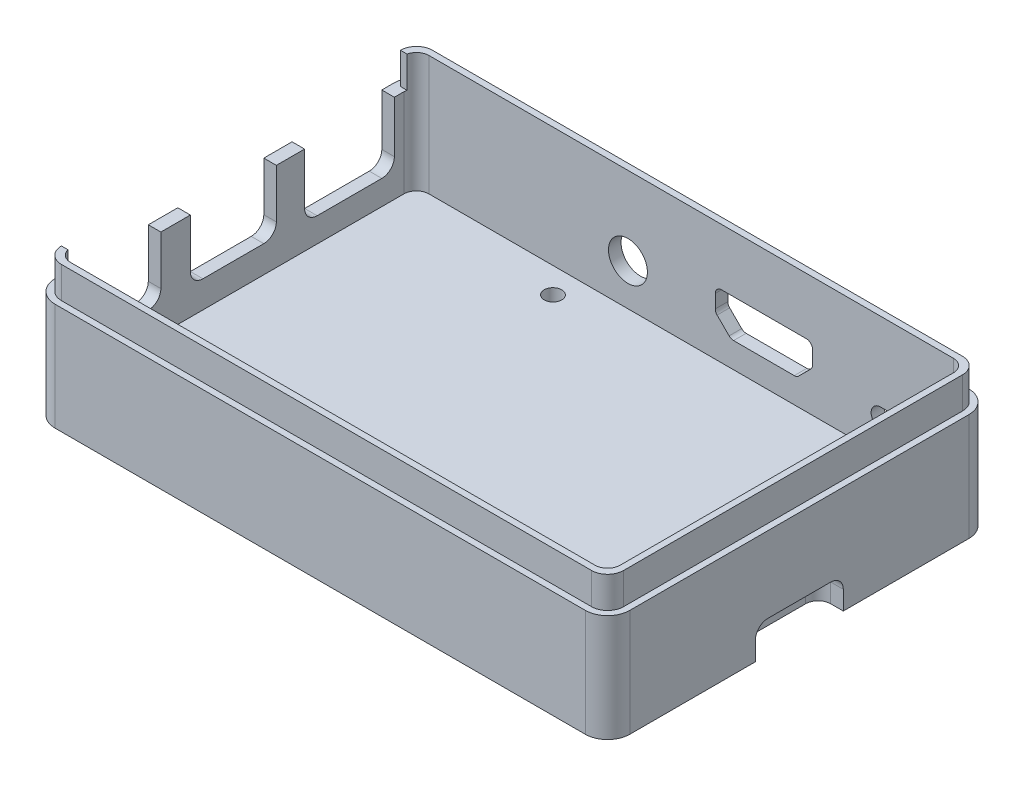
from build123d import *

# Parameters (mm, degrees)
SKETCH1_W                      = 86.55
SKETCH1_H                      = 17.1
BOSS_EXTRUDE1_DEPTH            = 14
SKETCH2_W                      = 88.55
SKETCH2_H                      = 17.1
BOSS_EXTRUDE2_DEPTH            = 23.55
SKETCH3_W                      = 37.55
SKETCH3_H                      = 17.1
BOSS_EXTRUDE3_DEPTH            = 2
SKETCH4_W                      = 90.55
SKETCH4_H                      = 17.1
BOSS_EXTRUDE4_DEPTH            = 23.55
SKETCH5_W                      = 2
SKETCH5_H                      = 14
CUT_EXTRUDE1_DEPTH             = 3
CUT_EXTRUDE2_DEPTH             = 14.1
SKETCH7_W                      = 2
SKETCH7_H                      = 14
CUT_EXTRUDE3_DEPTH             = 2
BOSS_EXTRUDE5_DEPTH            = 5
SKETCH9_W                      = 87.55
SKETCH9_H                      = 19.1
CUT_EXTRUDE4_DEPTH             = 1.55
SKETCH10_W                     = 61.1
SKETCH10_H                     = 17.1
BOSS_EXTRUDE6_DEPTH            = 1
CUT_EXTRUDE5_REACH             = 79.588
SKETCH11_W                     = 87.55
SKETCH11_H                     = 19.1
SKETCH12_W                     = 13.7
SKETCH12_H                     = 9.8
CUT_EXTRUDE6_DEPTH             = 127.470668932
SKETCH13_W                     = 13.7
SKETCH13_H                     = 9.8
CUT_EXTRUDE7_DEPTH             = 127.470668932
SKETCH14_W                     = 14.3
SKETCH14_H                     = 10.2
CUT_EXTRUDE8_DEPTH             = 127.470668932
CUT_EXTRUDE10_DEPTH            = 78.587821209
CUT_EXTRUDE11_REACH            = 81.122
F_2_8_2_8_DIAMETER_HOLE1_D     = 2.8
F_6_2_6_2_DIAMETER_HOLE1_D     = 6.2
F_6_2_6_2_DIAMETER_HOLE1_DEPTH = 2
FILLET1_R                      = 1
FILLET2_R                      = 2
FILLET3_R                      = 2.55
FILLET4_R                      = 3.55


with BuildPart() as part:
    # Sketch1 → Boss-Extrude1 (new body)
    with BuildSketch(Plane.XY.offset(63.69)):
        with Locations((-0.775, 5.55)):
            Rectangle(SKETCH1_W, SKETCH1_H)
    extrude(amount=-BOSS_EXTRUDE1_DEPTH)

    # Sketch2 → Boss-Extrude2 (add)
    with BuildSketch(Plane(origin=(0, 0, 49.69), x_dir=(-1, 0, 0), z_dir=(0, 0, -1))):
        with Locations((-0.225, 5.55)):
            Rectangle(SKETCH2_W, SKETCH2_H)
    extrude(amount=BOSS_EXTRUDE2_DEPTH)

    # Sketch3 → Boss-Extrude3 (add)
    with BuildSketch(Plane(origin=(44.5, 0, 0), x_dir=(0, 0, -1), z_dir=(1, 0, 0))):
        with Locations((-44.915, 5.55)):
            Rectangle(SKETCH3_W, SKETCH3_H)
    extrude(amount=BOSS_EXTRUDE3_DEPTH)

    # Sketch4 → Boss-Extrude4 (add)
    with BuildSketch(Plane.XY.offset(63.69)):
        with Locations((1.225, 5.55)):
            Rectangle(SKETCH4_W, SKETCH4_H)
    extrude(amount=BOSS_EXTRUDE4_DEPTH)

    # Sketch5 → Cut-Extrude1 (cut)
    with BuildSketch(Plane.XZ.offset(3)):
        with Locations((45.5, 56.69)):
            Rectangle(SKETCH5_W, SKETCH5_H)
    extrude(amount=-CUT_EXTRUDE1_DEPTH, mode=Mode.SUBTRACT)

    # Sketch6 → Cut-Extrude2 (cut)
    with BuildSketch(Plane(origin=(0, 14.1, 0), x_dir=(-1, 0, 0), z_dir=(0, 1, 0))):
        Polygon((43.05, 29.69), (43.05, 83.69), (-44.5, 83.69), (-44.5, 63.69), (-42.5, 63.69), (-42.5, 49.69), (-44.5, 49.69), (-44.5, 29.69), align=None)
    extrude(amount=-CUT_EXTRUDE2_DEPTH, mode=Mode.SUBTRACT)

    # Sketch7 → Cut-Extrude3 (cut)
    with BuildSketch(Plane.XZ):
        with Locations((45.5, 56.69)):
            Rectangle(SKETCH7_W, SKETCH7_H)
    extrude(amount=-CUT_EXTRUDE3_DEPTH, mode=Mode.SUBTRACT)

    # Sketch8 → Boss-Extrude5 (add)
    with BuildSketch(Plane(origin=(0, 14.1, 0), x_dir=(-1, 0, 0), z_dir=(0, 1, 0))):
        with BuildLine():
            Line((-44.5, 83.69), (-44.5, 29.69))
            Line((-44.5, 29.69), (44.05, 29.69))
            ThreePointArc((44.05, 29.69), (43.303122292, 27.886877708), (41.5, 27.14))
            Line((41.5, 27.14), (-45.5, 27.14))
            Line((-45.5, 27.14), (-45.5, 86.24))
            Line((-45.5, 86.24), (41.5, 86.24))
            ThreePointArc((41.5, 86.24), (43.303122292, 85.493122292), (44.05, 83.69))
            Line((44.05, 83.69), (-44.5, 83.69))
        make_face()
    extrude(amount=BOSS_EXTRUDE5_DEPTH)

    # Sketch9 → Cut-Extrude4 (cut)
    with BuildSketch(Plane(origin=(0, 0, 83.69), x_dir=(-1, 0, 0), z_dir=(0, 0, -1))):
        with Locations((-0.725, 9.55)):
            Rectangle(SKETCH9_W, SKETCH9_H)
    extrude(amount=-CUT_EXTRUDE4_DEPTH, mode=Mode.SUBTRACT)

    # Sketch10 → Boss-Extrude6 (add)
    with BuildSketch(Plane.ZY.offset(44.05)):
        with Locations((56.69, 5.55)):
            Rectangle(SKETCH10_W, SKETCH10_H)
    extrude(amount=BOSS_EXTRUDE6_DEPTH)

    # Sketch11 → Cut-Extrude5 (cut, up to next)
    with BuildSketch(Plane(origin=(0, 0, 28.14), x_dir=(-1, 0, 0), z_dir=(0, 0, -1)), mode=Mode.PRIVATE) as cut_extrude5_sk1:
        with Locations((-0.725, 9.55)):
            Rectangle(SKETCH11_W, SKETCH11_H)
    cut_extrude5_tool1 = extrude(cut_extrude5_sk1.sketch, amount=-CUT_EXTRUDE5_REACH, mode=Mode.PRIVATE) & part.part
    add(cut_extrude5_tool1.solids().sort_by_distance((0.725, 9.55, 28.14))[0], mode=Mode.SUBTRACT)

    # Sketch12 → Cut-Extrude6 (cut, through all)
    with BuildSketch(Plane(origin=(-43.05, 0, 0), x_dir=(0, 0, -1), z_dir=(1, 0, 0))):
        with Locations((-75.705690784, 9.2)):
            Rectangle(SKETCH12_W, SKETCH12_H)
    extrude(amount=-CUT_EXTRUDE6_DEPTH, mode=Mode.SUBTRACT)

    # Sketch13 → Cut-Extrude7 (cut, through all)
    with BuildSketch(Plane(origin=(-43.05, 0, 0), x_dir=(0, 0, -1), z_dir=(1, 0, 0))):
        with Locations((-57.305690784, 9.2)):
            Rectangle(SKETCH13_W, SKETCH13_H)
    extrude(amount=-CUT_EXTRUDE7_DEPTH, mode=Mode.SUBTRACT)

    # Sketch14 → Cut-Extrude8 (cut, through all)
    with BuildSketch(Plane(origin=(-43.05, 0, 0), x_dir=(0, 0, -1), z_dir=(1, 0, 0))):
        with Locations((-38.80469145, 9)):
            Rectangle(SKETCH14_W, SKETCH14_H)
    extrude(amount=-CUT_EXTRUDE8_DEPTH, mode=Mode.SUBTRACT)

    # Sketch16 → Cut-Extrude10 (cut, through all)
    with BuildSketch(Plane.XY.offset(28.14)):
        Polygon((20.057791158, 10.08), (4.557791136, 10.08), (4.557791136, 6.52999997), (7.057791136, 4.02999997), (17.557791158, 4.02999997), (20.057791158, 6.52999997), align=None)
    extrude(amount=-CUT_EXTRUDE10_DEPTH, mode=Mode.SUBTRACT)

    # Sketch17 → Cut-Extrude11 (cut, up to next)
    with BuildSketch(Plane(origin=(0, 0, 26.14), x_dir=(-1, 0, 0), z_dir=(0, 0, -1)), mode=Mode.PRIVATE) as cut_extrude11_sk1:
        with BuildLine():
            Line((-36.3834392, 6.568002867), (-30.8834392, 6.568002867))
            ThreePointArc((-30.8834392, 6.568002867), (-29.3834392, 5.068002867), (-30.8834392, 3.568002867))
            Line((-30.8834392, 3.568002867), (-36.3834392, 3.568002867))
            ThreePointArc((-36.3834392, 3.568002867), (-37.8834392, 5.068002867), (-36.3834392, 6.568002867))
        make_face()
    cut_extrude11_tool1 = extrude(cut_extrude11_sk1.sketch, amount=-CUT_EXTRUDE11_REACH, mode=Mode.PRIVATE) & part.part
    add(cut_extrude11_tool1.solids().sort_by_distance((33.633439, 5.068003, 26.14))[0], mode=Mode.SUBTRACT)

    # Ø2.8 (2.8) Diameter Hole1 (through all)
    with Locations(Plane(origin=(0, 0, 0), x_dir=(1, 0, 0), z_dir=(0, 1, 0))):
        with Locations((40.75, -81.19), (40.75, -32.19), (-17.25, -32.19), (-17.25, -81.19)):
            Hole(F_2_8_2_8_DIAMETER_HOLE1_D / 2)

    # Ø6.2 (6.2) Diameter Hole1
    with Locations(Plane(origin=(0, 0, 26.14), x_dir=(-1, 0, 0), z_dir=(0, 0, -1))):
        with Locations((9.353475334, 6.6)):
            Hole(F_6_2_6_2_DIAMETER_HOLE1_D / 2, depth=F_6_2_6_2_DIAMETER_HOLE1_DEPTH)

    # Fillet1
    fillet1_edges = [part.edges().sort_by_distance(p)[0] for p in [
        (20.057791158, 10.08, 27.14),
        (20.057791158, 6.52999997, 27.14),
        (17.557791158, 4.02999997, 27.14),
        (7.057791136, 4.02999997, 27.14),
        (4.557791136, 6.52999997, 27.14),
        (4.557791136, 10.08, 27.14),
    ]]
    fillet(fillet1_edges, radius=FILLET1_R)

    # Fillet2
    fillet2_edges = [part.edges().sort_by_distance(p)[0] for p in [
        (42.5, -1.5, 49.69),
        (42.5, -1.5, 63.69),
        (-44.05, 4.3, 82.555690784),
        (45.5, 2, 63.69),
        (-44.05, 4.3, 64.155690784),
        (-43.05, 9.55, 85.24),
        (44.5, 9.55, 85.24),
        (-44.05, 4.3, 50.455690784),
        (45.5, 2, 49.69),
        (-44.05, 3.9, 45.95469145),
        (-44.05, 4.3, 68.855690784),
        (-44.05, 3.9, 31.65469145),
        (44.5, 9.55, 28.14),
        (-43.05, 9.55, 28.14),
    ]]
    fillet(fillet2_edges, radius=FILLET2_R)

    # Fillet3
    fillet3_edges = [part.edges().sort_by_distance(p)[0] for p in [
        (45.5, 16.6, 86.24),
        (45.5, 16.6, 27.14),
    ]]
    fillet(fillet3_edges, radius=FILLET3_R)

    # Fillet4
    fillet4_edges = [part.edges().sort_by_distance(p)[0] for p in [
        (-45.05, 5.55, 26.14),
        (-45.05, 5.55, 87.24),
        (46.5, 5.55, 26.14),
        (46.5, 5.55, 87.24),
    ]]
    fillet(fillet4_edges, radius=FILLET4_R)


solid = part.part
